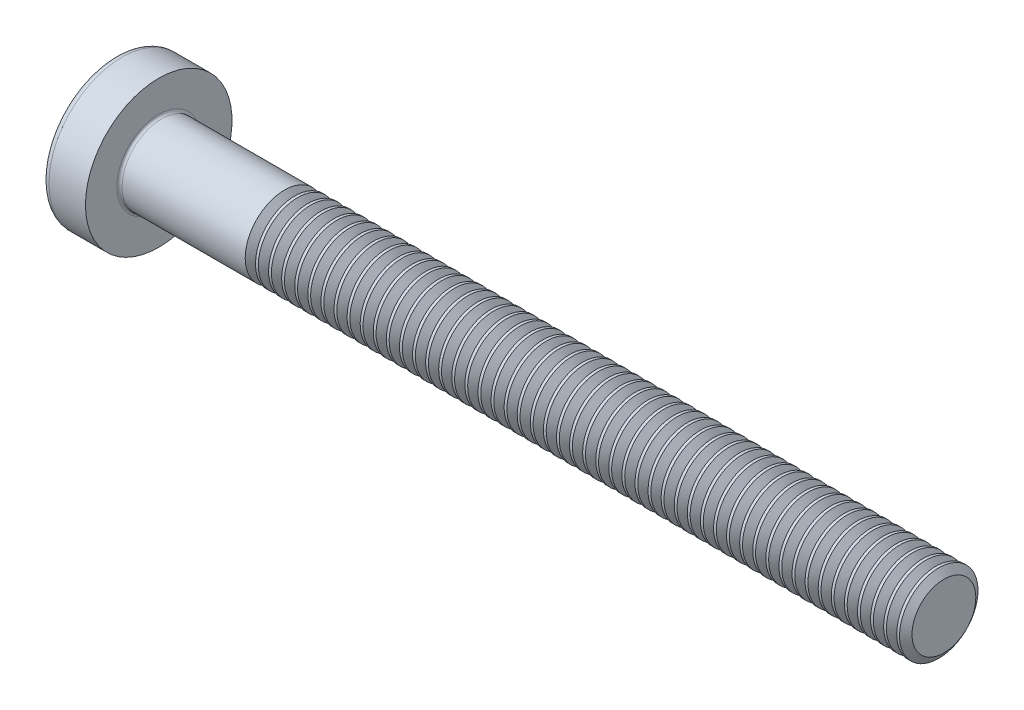
from build123d import *

# Parameters (mm, degrees)
FILLET1_R       = 0.1
RECPAT_COUNT    = 2
RECPAT_ANGLE    = 90
THDSCHPAT_COUNT = 51
THDSCHPAT_PITCH = 0.5


with BuildPart() as part:
    # BodySke → Base-Revolve (revolve)
    with BuildSketch(Plane.XY, mode=Mode.PRIVATE) as base_revolve_sk:
        with BuildLine():
            Line((2.4, 1.5), (2.4, 2.8))
            Line((2.4, 2.8), (1.003501533, 2.8))
            ThreePointArc((1.003501533, 2.8), (0.873295971, 2.76653015), (0.775371599, 2.674418605))
            ThreePointArc((0.775371599, 2.674418605), (0.197753546, 1.392274756), (0, 0))
            Line((0, 0), (32.4, 0))
            Line((32.4, 0), (32.4, 1.5))
            Line((32.4, 1.5), (2.4, 1.5))
        make_face()
    revolve(base_revolve_sk.sketch.rotate(Axis((1.003501533, 0, 0), (1, 0, 0)), 90), axis=Axis((1.003501533, 0, 0), (1, 0, 0)))

    # Fillet1
    fillet1_edges = [part.edges().sort_by_distance(p)[0] for p in [
        (2.4, 0, -1.5),
    ]]
    fillet(fillet1_edges, radius=FILLET1_R)

    # Sketch3 → Recess section 0
    with BuildSketch(Plane(origin=(0, 0, 0), x_dir=(0, 0, -1), z_dir=(1, 0, 0))):
        with BuildLine():
            Line((0.37, -1.4), (-0.37, -1.4))
            Line((-0.37, -1.4), (-0.37, 1.4))
            Line((-0.37, 1.4), (0.37, 1.4))
            Line((0.37, 1.4), (0.37, -1.4))
        make_face()
    # Sketch4 → Recess section 1
    with BuildSketch(Plane(origin=(1.75, 0, 0), x_dir=(0, 0, -1), z_dir=(1, 0, 0))):
        with BuildLine():
            Line((0.37, -0.527482332), (-0.37, -0.527482332))
            Line((-0.37, -0.527482332), (-0.37, 0.527482332))
            Line((-0.37, 0.527482332), (0.37, 0.527482332))
            Line((0.37, 0.527482332), (0.37, -0.527482332))
        make_face()
    recess = loft(mode=Mode.SUBTRACT)

    # RecPat: Recess ×2 about axis
    recpat_axis = Axis((0, 0, 0), (1, 0, 0))
    for i in range(1, RECPAT_COUNT):
        add(recess.rotate(recpat_axis, i * RECPAT_ANGLE / (RECPAT_COUNT - 1)), mode=Mode.SUBTRACT)

    # RecCorSke → RecessCore (revolve, cut)
    with BuildSketch(Plane.XY, mode=Mode.PRIVATE) as recesscore_sk:
        Polygon((0, 0), (0, 0.678371921), (1.75, 0.556), (1.930655351, 0), align=None)
    revolve(recesscore_sk.sketch.rotate(Axis((-3.175, 0, 0), (1, 0, 0)), 15.814025638), axis=Axis((-3.175, 0, 0), (1, 0, 0)), mode=Mode.SUBTRACT)

    # ThdSchSke → ThreadSchematic (revolve, cut)
    with BuildSketch(Plane.XY, mode=Mode.PRIVATE) as threadschematic_sk:
        Polygon((7.4, -1.2195), (7.203591786, -1.5), (7.203591786, -1.875), (7.596408214, -1.875), (7.596408214, -1.5), align=None)
    threadschematic = revolve(threadschematic_sk.sketch.rotate(Axis((-3.175, 0, 0), (1, 0, 0)), 270), axis=Axis((-3.175, 0, 0), (1, 0, 0)), mode=Mode.SUBTRACT)

    # ThdSchPat: ThreadSchematic ×51
    with Locations(*[(i * THDSCHPAT_PITCH, 0, 0) for i in range(1, THDSCHPAT_COUNT)]):
        add(threadschematic, mode=Mode.SUBTRACT)


solid = part.part
